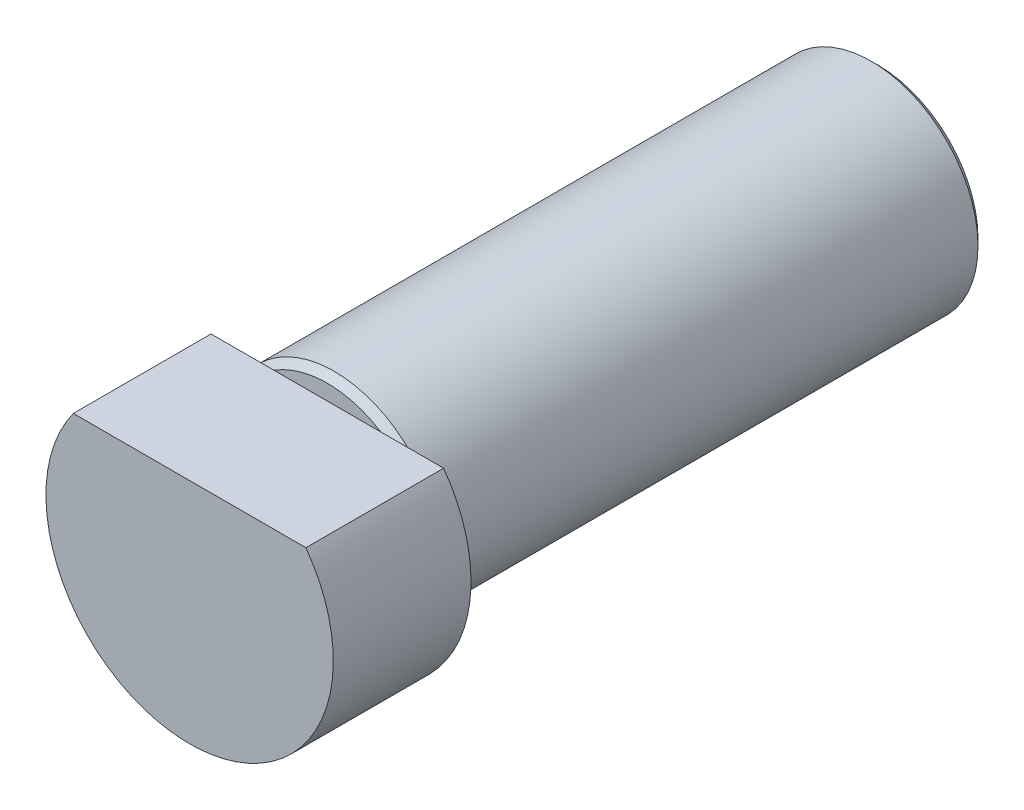
from build123d import *

# Parameters (mm, degrees)
SKETCH2_R           = 0.775
BOSS_EXTRUDE1_DEPTH = 4
CHAMFER2_SIZE       = 0.05
BOSS_EXTRUDE2_DEPTH = 1


with BuildPart() as part:
    # Sketch2 → Boss-Extrude1 (new body)
    with BuildSketch(Plane.XY):
        Circle(SKETCH2_R)
    extrude(amount=BOSS_EXTRUDE1_DEPTH)

    # Chamfer2
    chamfer2_edges = [part.edges().sort_by_distance(p)[0] for p in [
        (-0.775, 0, 0),
        (-0.775, 0, 4),
    ]]
    chamfer(chamfer2_edges, length=CHAMFER2_SIZE)

    # Sketch3 → Boss-Extrude2 (add)
    with BuildSketch(Plane.XY.offset(4)):
        with BuildLine():
            Line((-0.844567845, 0.612649901), (0.844567845, 0.612649901))
            ThreePointArc((0.844567845, 0.612649901), (0, -1.043376608), (-0.844567845, 0.612649901))
        make_face()
    extrude(amount=BOSS_EXTRUDE2_DEPTH)


solid = part.part
